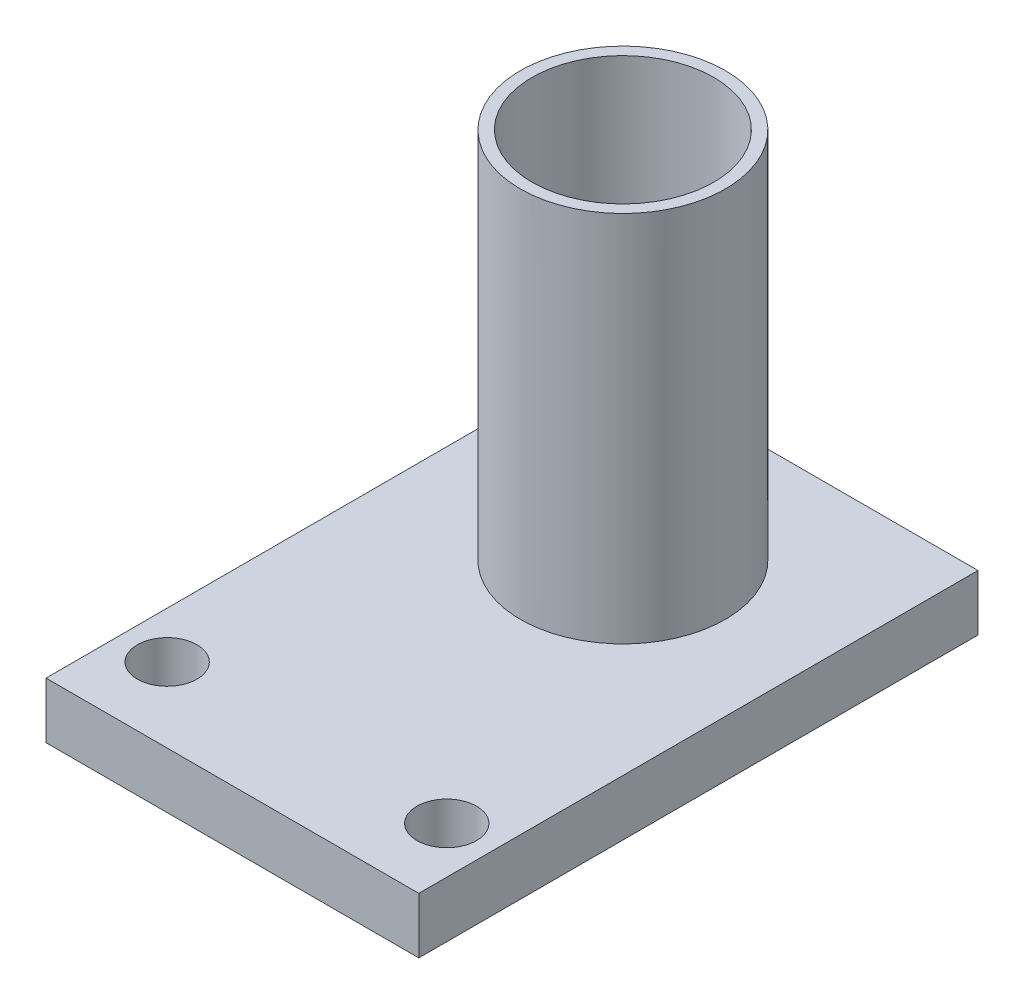
from build123d import *

# Parameters (mm, degrees)
SKETCH1_W                = 20
SKETCH1_H                = 30
BOSS_EXTRUDE1_DEPTH      = 3
M3_CLEARANCE_HOLE1_D     = 3.2
M3_CLEARANCE_HOLE1_DEPTH = 5
M3_CLEARANCE_HOLE1_TIP   = 0.96137699
SKETCH4_R                = 4.875
CUT_EXTRUDE1_DEPTH       = 3
BOSS_EXTRUDE2_START      = 20
SKETCH5_R                = 5.5
SKETCH5_R_2              = 4.875
BOSS_EXTRUDE2_DEPTH      = 20


with BuildPart() as part:
    # Sketch1 → Boss-Extrude1 (new body)
    with BuildSketch(Plane(origin=(0, 0, 0), x_dir=(1, 0, 0), z_dir=(0, 1, 0))):
        Rectangle(SKETCH1_W, SKETCH1_H)
    extrude(amount=BOSS_EXTRUDE1_DEPTH)

    # M3 Clearance Hole1
    with Locations(Plane(origin=(-7.5, 3, 11), x_dir=(0, 0, 1), z_dir=(0, 1, 0))):
        with Locations((0, 0), (0, 15)):
            Hole(M3_CLEARANCE_HOLE1_D / 2, depth=M3_CLEARANCE_HOLE1_DEPTH)
            with Locations((0, 0, -(M3_CLEARANCE_HOLE1_DEPTH + M3_CLEARANCE_HOLE1_TIP / 2))):  # 118° drill point
                Cone(0, M3_CLEARANCE_HOLE1_D / 2, M3_CLEARANCE_HOLE1_TIP, mode=Mode.SUBTRACT)

    # Sketch4 → Cut-Extrude1 (cut)
    with BuildSketch(Plane(origin=(0, 3, 0), x_dir=(1, 0, 0), z_dir=(0, 1, 0))):
        with Locations(Location((0, 5.95, 0), (0, 0, 270))):
            Circle(SKETCH4_R)
    extrude(amount=-CUT_EXTRUDE1_DEPTH, mode=Mode.SUBTRACT)

    # Sketch5 → Boss-Extrude2 (add)
    with BuildSketch(Plane(origin=(0, 3, 0), x_dir=(1, 0, 0), z_dir=(0, 1, 0)).offset(BOSS_EXTRUDE2_START)):
        with Locations(Location((0, 5.95, 0), (0, 0, 90))):
            Circle(SKETCH5_R)
        with Locations(Location((0, 5.95, 0), (0, 0, 270))):
            Circle(SKETCH5_R_2, mode=Mode.SUBTRACT)
    extrude(amount=-BOSS_EXTRUDE2_DEPTH)


solid = part.part
